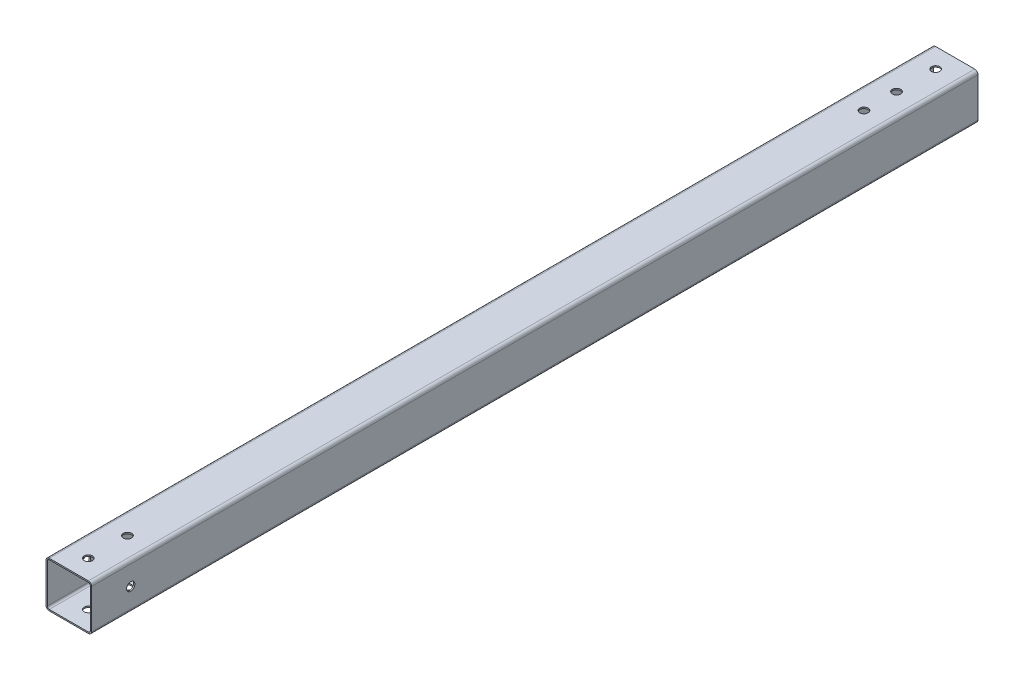
from build123d import *

# Parameters (mm, degrees)
TUBO_CUADRADO_3_X_3_X_0_25_1_DEPTH = 1360
CROQUIS3_R                         = 6.35
CORTAR_EXTRUIR1_DEPTH              = 685.488860391
CROQUIS4_R                         = 6.35
CORTAR_EXTRUIR2_DEPTH              = 685.488860391


with BuildPart() as part:
    # Sketch1 → Tubo cuadrado 3 X 3 X 0.25(1) (new body)
    with BuildSketch(Plane(origin=(0, 0, -680), x_dir=(0, -1, 0), z_dir=(0, 0, 1))):
        with BuildLine():
            Line((-30, -35), (30, -35))
            ThreePointArc((30, -35), (33.535533906, -33.535533906), (35, -30))
            Line((35, -30), (35, 30))
            ThreePointArc((35, 30), (33.535533906, 33.535533906), (30, 35))
            Line((30, 35), (-30, 35))
            ThreePointArc((-30, 35), (-33.535533906, 33.535533906), (-35, 30))
            Line((-35, 30), (-35, -30))
            ThreePointArc((-35, -30), (-33.535533906, -33.535533906), (-30, -35))
        make_face()
        with BuildLine():
            Line((-30, -33), (30, -33))
            ThreePointArc((30, -33), (32.121320344, -32.121320344), (33, -30))
            Line((33, -30), (33, 30))
            ThreePointArc((33, 30), (32.121320344, 32.121320344), (30, 33))
            Line((30, 33), (-30, 33))
            ThreePointArc((-30, 33), (-32.121320344, 32.121320344), (-33, 30))
            Line((-33, 30), (-33, -30))
            ThreePointArc((-33, -30), (-32.121320344, -32.121320344), (-30, -33))
        make_face(mode=Mode.SUBTRACT)
    extrude(amount=TUBO_CUADRADO_3_X_3_X_0_25_1_DEPTH)

    # Croquis3 → Cortar-Extruir1 (cut, through all)
    with BuildSketch(Plane.XZ.offset(35)):
        with Locations(Location((0, 650, 0), (0, 0, 270))):
            Circle(CROQUIS3_R)
        with Locations(Location((0, 590, 0), (0, 0, 270))):
            Circle(CROQUIS3_R)
        with Locations(Location((0, -590, 0), (0, 0, 90))):
            Circle(CROQUIS3_R)
        with Locations(Location((0, -650, 0), (0, 0, 90))):
            Circle(CROQUIS3_R)
        with Locations(Location((0, -540, 0), (0, 0, 270))):
            Circle(CROQUIS3_R)
    extrude(amount=-CORTAR_EXTRUIR1_DEPTH, mode=Mode.SUBTRACT)

    # Croquis4 → Cortar-Extruir2 (cut, through all)
    with BuildSketch(Plane.ZY.offset(35)):
        with Locations((620, 0)):
            Circle(CROQUIS4_R)
    extrude(amount=-CORTAR_EXTRUIR2_DEPTH, mode=Mode.SUBTRACT)


solid = part.part
